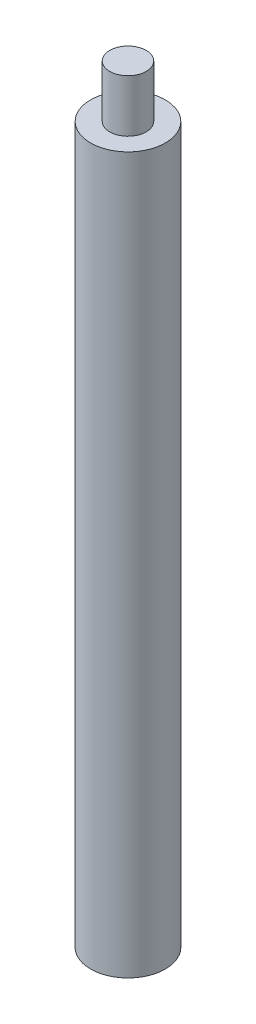
from build123d import *

# Parameters (mm, degrees)
SKETCH2_R           = 8.2
BOSS_EXTRUDE1_DEPTH = 157
SKETCH4_R           = 2.1
CUT_EXTRUDE2_DEPTH  = 10
SKETCH3_R           = 4
BOSS_EXTRUDE2_DEPTH = 11.5


with BuildPart() as part:
    # Sketch2 → Boss-Extrude1 (new body)
    with BuildSketch(Plane(origin=(0, 0, 0), x_dir=(1, 0, 0), z_dir=(0, 1, 0))):
        with Locations(Location((0, 0, 0), (0, 0, 270))):
            Circle(SKETCH2_R)
    extrude(amount=BOSS_EXTRUDE1_DEPTH)

    # Sketch4 → Cut-Extrude2 (cut)
    with BuildSketch(Plane.XZ):
        with Locations(Location((0, 0, 0), (0, 0, 270))):
            Circle(SKETCH4_R)
    extrude(amount=-CUT_EXTRUDE2_DEPTH, mode=Mode.SUBTRACT)

    # Sketch3 → Boss-Extrude2 (add)
    with BuildSketch(Plane(origin=(0, 157, 0), x_dir=(1, 0, 0), z_dir=(0, 1, 0))):
        with Locations(Location((0, 0, 0), (0, 0, 270))):
            Circle(SKETCH3_R)
    extrude(amount=BOSS_EXTRUDE2_DEPTH)


solid = part.part
